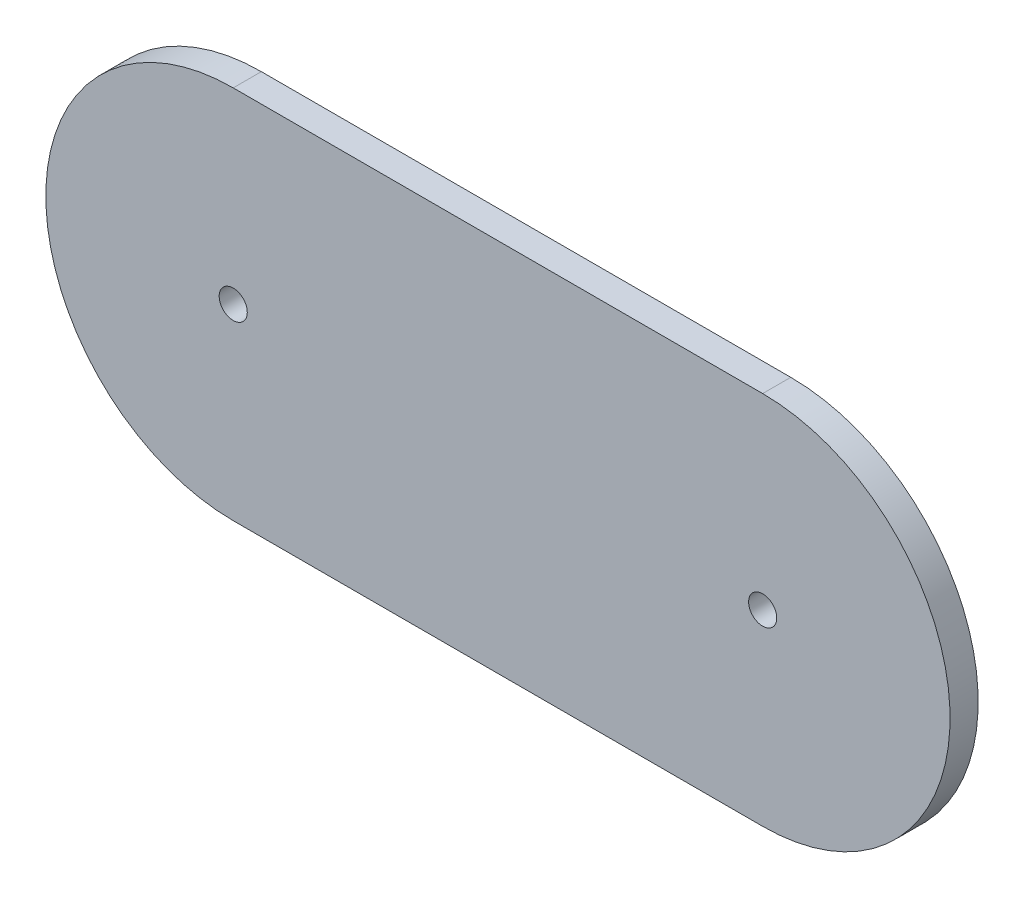
from build123d import *

# Parameters (mm, degrees)
SKETCH1_R           = 1.5
BOSS_EXTRUDE1_DEPTH = 3


with BuildPart() as part:
    # Sketch1 → Boss-Extrude1 (new body)
    with BuildSketch(Plane.XY):
        with BuildLine():
            Line((-28.25, 20), (28.25, 20))
            ThreePointArc((28.25, 20), (48.25, 0), (28.25, -20))
            Line((28.25, -20), (-28.25, -20))
            ThreePointArc((-28.25, -20), (-48.25, 0), (-28.25, 20))
        make_face()
        with Locations((-28.25, 0)):
            Circle(SKETCH1_R, mode=Mode.SUBTRACT)
        with Locations((28.25, 0)):
            Circle(SKETCH1_R, mode=Mode.SUBTRACT)
    extrude(amount=BOSS_EXTRUDE1_DEPTH)


solid = part.part
